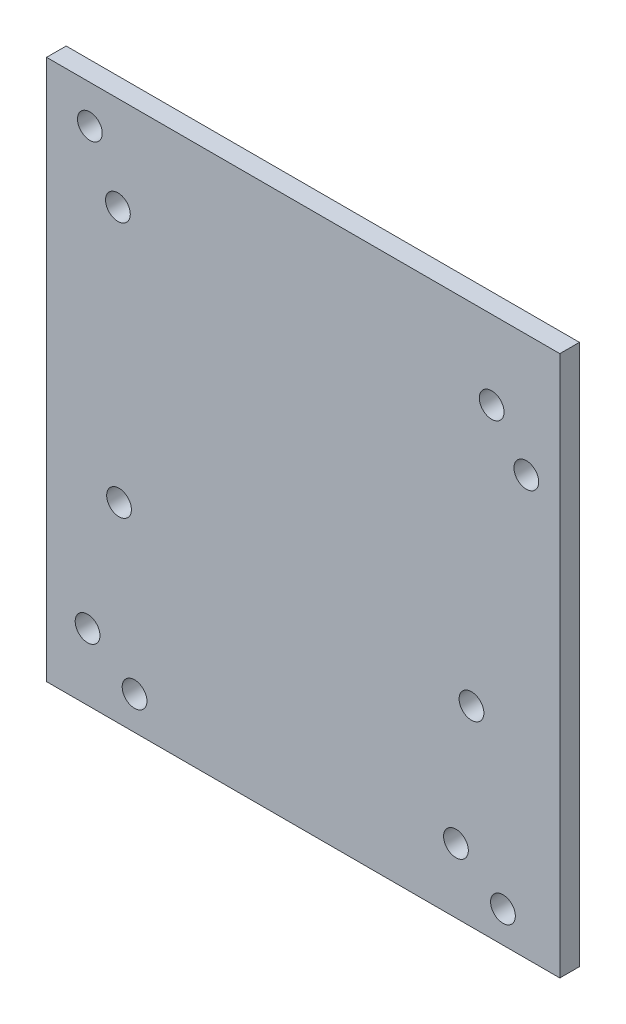
from build123d import *

# Parameters (mm, degrees)
SKETCH1_W           = 166.44628819
SKETCH1_H           = 175.350054565
SKETCH1_R           = 4.0127
SKETCH1_R_2         = 4.0132
BOSS_EXTRUDE1_DEPTH = 6.35


with BuildPart() as part:
    # Sketch1 → Boss-Extrude1 (new body)
    with BuildSketch(Plane.XY):
        with Locations((-612.934360792, 295.578292869)):
            Rectangle(SKETCH1_W, SKETCH1_H)
        with Locations((-667.625800723, 218.698265586)):
            Circle(SKETCH1_R, mode=Mode.SUBTRACT)
        with Locations((-682.865800723, 229.493265586)):
            Circle(SKETCH1_R, mode=Mode.SUBTRACT)
        with Locations((-682.121778024, 370.932816424)):
            Circle(SKETCH1_R, mode=Mode.SUBTRACT)
        with Locations((-673.025414388, 352.751458015)):
            Circle(SKETCH1_R, mode=Mode.SUBTRACT)
        with Locations((-551.816021726, 357.766762234)):
            Circle(SKETCH1_R, mode=Mode.SUBTRACT)
        with Locations((-540.572963718, 343.760561942)):
            Circle(SKETCH1_R, mode=Mode.SUBTRACT)
        with Locations((-548.15692674, 218.063265586)):
            Circle(SKETCH1_R, mode=Mode.SUBTRACT)
        with Locations((-563.39692674, 228.858265586)):
            Circle(SKETCH1_R, mode=Mode.SUBTRACT)
        with Locations((-558.361573731, 269.972580351)):
            Circle(SKETCH1_R_2, mode=Mode.SUBTRACT)
        with Locations((-672.661153731, 269.972580351)):
            Circle(SKETCH1_R_2, mode=Mode.SUBTRACT)
    extrude(amount=BOSS_EXTRUDE1_DEPTH)


with BuildPart() as part_1:
    # Body-Move/Copy1: moved
    add(part.part.moved(Location((0, 0, -6.35))))


solid = part_1.part
